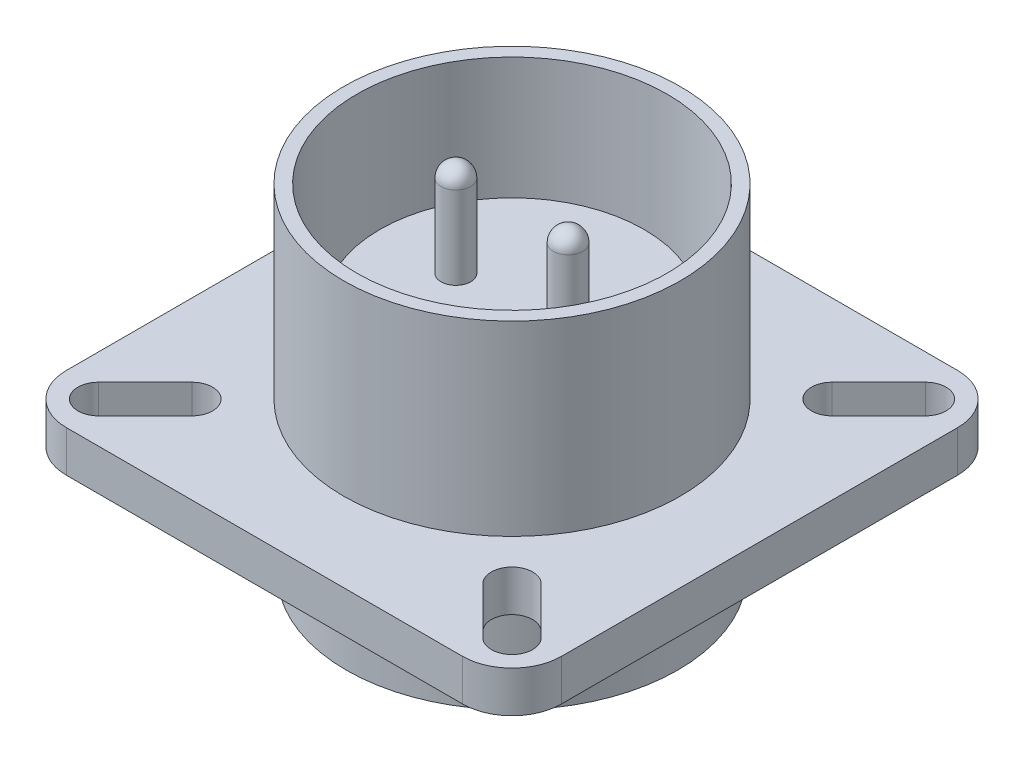
from build123d import *

# Parameters (mm, degrees)
SKETCH1_W           = 30
SKETCH1_H           = 30
EXTRUDE1_DEPTH      = 2.5
FILLET2_R           = 3
SKETCH3_R           = 10.2
SKETCH3_R_2         = 9.4
EXTRUDE2_DEPTH      = 11.3
EXTRUDE3_DEPTH      = 4.9
EXTRUDE3_DEPTH_BACK = 6.7
SKETCH4_R           = 8
EXTRUDE4_DEPTH      = 5.9
EXTRUDE4_DEPTH_BACK = 17
SKETCH5_R           = 0.9
FILLET3_R           = 0.9
SKETCH6_R           = 10.05
SKETCH6_R_2         = 9.55
EXTRUDE5_DEPTH      = 6.7
CUT_EXTRUDE1_DEPTH  = 5
SKETCH8_R           = 9.55
SKETCH8_R_2         = 8
EXTRUDE7_DEPTH      = 5.5
CUT_EXTRUDE2_DEPTH  = 1


with BuildPart() as part:
    # Sketch1 → Extrude1 (new body)
    with BuildSketch(Plane(origin=(0, 0, 0), x_dir=(1, 0, 0), z_dir=(0, 1, 0))):
        Rectangle(SKETCH1_W, SKETCH1_H)
        with BuildLine():
            Line((13.409009742, 11.641242789), (10.580582618, 8.812815665))
            ThreePointArc((10.580582618, 8.812815665), (8.812815665, 8.812815665), (8.812815665, 10.580582618))
            Line((8.812815665, 10.580582618), (11.641242789, 13.409009742))
            ThreePointArc((11.641242789, 13.409009742), (13.409009742, 13.409009742), (13.409009742, 11.641242789))
        make_face(mode=Mode.SUBTRACT)
        with BuildLine():
            Line((-13.409009742, 11.641242789), (-10.580582618, 8.812815665))
            ThreePointArc((-10.580582618, 8.812815665), (-8.812815665, 8.812815665), (-8.812815665, 10.580582618))
            Line((-8.812815665, 10.580582618), (-11.641242789, 13.409009742))
            ThreePointArc((-11.641242789, 13.409009742), (-13.409009742, 13.409009742), (-13.409009742, 11.641242789))
        make_face(mode=Mode.SUBTRACT)
        with BuildLine():
            Line((-11.641242789, -13.409009742), (-8.812815665, -10.580582618))
            ThreePointArc((-8.812815665, -10.580582618), (-8.812815665, -8.812815665), (-10.580582618, -8.812815665))
            Line((-10.580582618, -8.812815665), (-13.409009742, -11.641242789))
            ThreePointArc((-13.409009742, -11.641242789), (-13.409009742, -13.409009742), (-11.641242789, -13.409009742))
        make_face(mode=Mode.SUBTRACT)
        with BuildLine():
            Line((11.641242789, -13.409009742), (8.812815665, -10.580582618))
            ThreePointArc((8.812815665, -10.580582618), (8.812815665, -8.812815665), (10.580582618, -8.812815665))
            Line((10.580582618, -8.812815665), (13.409009742, -11.641242789))
            ThreePointArc((13.409009742, -11.641242789), (13.409009742, -13.409009742), (11.641242789, -13.409009742))
        make_face(mode=Mode.SUBTRACT)
    extrude(amount=EXTRUDE1_DEPTH)

    # Fillet2
    fillet2_edges = [part.edges().sort_by_distance(p)[0] for p in [
        (15, 1.25, 15),
        (-15, 1.25, 15),
        (-15, 1.25, -15),
        (15, 1.25, -15),
    ]]
    fillet(fillet2_edges, radius=FILLET2_R)

    # Sketch3 → Extrude2 (add)
    with BuildSketch(Plane(origin=(0, 2.5, 0), x_dir=(1, 0, 0), z_dir=(0, 1, 0))):
        with Locations(Location((0, 0, 0), (0, 0, 270))):
            Circle(SKETCH3_R)
        with Locations(Location((0, 0, 0), (0, 0, 270))):
            Circle(SKETCH3_R_2, mode=Mode.SUBTRACT)
    extrude(amount=EXTRUDE2_DEPTH)

    # Sketch4 → Extrude3 (add, two sides: drawn at the far end of the back side and taken through both)
    with BuildSketch(Plane(origin=(0, 2.5, 0), x_dir=(1, 0, 0), z_dir=(0, 1, 0)).offset(-EXTRUDE3_DEPTH_BACK)):
        with Locations(Location((0, 0, 0), (0, 0, 270))):
            Circle(SKETCH4_R)
    extrude(amount=EXTRUDE3_DEPTH + EXTRUDE3_DEPTH_BACK)

    # Sketch5 → Extrude4 (add, two sides: drawn at the far end of the back side and taken through both)
    with BuildSketch(Plane(origin=(0, 7.4, 0), x_dir=(1, 0, 0), z_dir=(0, 1, 0)).offset(-EXTRUDE4_DEPTH_BACK)):
        with Locations(Location((3.4, 0, 0), (0, 0, 270))):
            Circle(SKETCH5_R)
        with Locations(Location((-3.4, 0, 0), (0, 0, 270))):
            Circle(SKETCH5_R)
    extrude(amount=EXTRUDE4_DEPTH + EXTRUDE4_DEPTH_BACK)

    # Fillet3
    fillet3_edges = [part.edges().sort_by_distance(p)[0] for p in [
        (3.4, 13.3, -0.9),
        (-3.4, 13.3, -0.9),
    ]]
    fillet(fillet3_edges, radius=FILLET3_R)

    # Sketch6 → Extrude5 (add)
    with BuildSketch(Plane.XZ):
        with Locations(Location((0, 0, 0), (0, 0, 90))):
            Circle(SKETCH6_R)
        with Locations(Location((0, 0, 0), (0, 0, 270))):
            Circle(SKETCH6_R_2, mode=Mode.SUBTRACT)
    extrude(amount=EXTRUDE5_DEPTH)

    # Sketch7 → Cut-Extrude1 (cut)
    with BuildSketch(Plane.XZ.offset(9.6)):
        with BuildLine():
            Line((3.4, 0.9), (3.4, 0.6))
            ThreePointArc((3.4, 0.6), (2.8, 0), (3.4, -0.6))
            Line((3.4, -0.6), (3.4, -0.9))
            ThreePointArc((3.4, -0.9), (4.3, 0), (3.4, 0.9))
        make_face()
        with BuildLine():
            Line((-3.4, -0.6), (-3.4, -0.9))
            ThreePointArc((-3.4, -0.9), (-2.5, 0), (-3.4, 0.9))
            Line((-3.4, 0.9), (-3.4, 0.6))
            ThreePointArc((-3.4, 0.6), (-4, 0), (-3.4, -0.6))
        make_face()
    extrude(amount=-CUT_EXTRUDE1_DEPTH, mode=Mode.SUBTRACT)

    # Sketch8 → Extrude7 (add)
    with BuildSketch(Plane.XZ):
        with Locations(Location((0, 0, 0), (0, 0, 270))):
            Circle(SKETCH8_R)
        with Locations(Location((0, 0, 0), (0, 0, 90))):
            Circle(SKETCH8_R_2, mode=Mode.SUBTRACT)
    extrude(amount=EXTRUDE7_DEPTH)

    # Sketch9 → Cut-Extrude2 (cut)
    with BuildSketch(Plane.XZ.offset(5.5)):
        Polygon((-4.635007145, -8.409471372), (6.276512407, 7.26690388), (4.635007145, 8.409471372), (-6.276512407, -7.26690388), align=None)
    extrude(amount=-CUT_EXTRUDE2_DEPTH, mode=Mode.SUBTRACT)


solid = part.part
